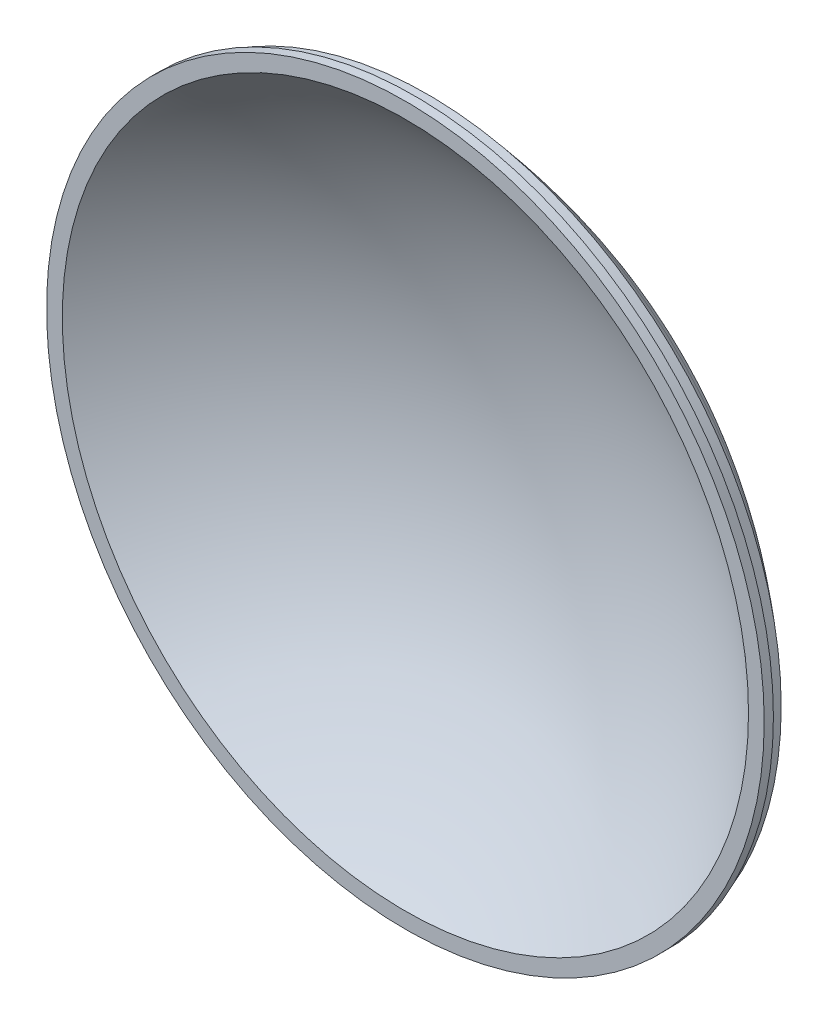
from build123d import *


with BuildPart() as part:
    # Sketch1 → Revolve2 (revolve)
    with BuildSketch(Plane(origin=(0, 0, 0), x_dir=(1, 0, 0), z_dir=(0, 1, 0))):
        with BuildLine():
            add(Edge.make_bspline(
                [(-0.008083422, 15.738478713), (0.28571155, 15.738629609), (0.840812888, 15.738004231), (1.868394508, 15.734546317), (2.901173429, 15.728381524), (4.227582271, 15.716441804), (5.821418054, 15.69484135), (8.416160181, 15.646050859), (11.658122448, 15.557987963), (16.84007731, 15.35978384), (23.313200419, 15.004179178), (33.65701245, 14.205024157), (46.550373188, 12.773741337), (77.317227425, 7.956225698), (122.56941407, -4.479354526), (169.462252379, -27.143119309), (204.131428921, -49.805714308), (220.433111859, -62.443094396), (228.3409107, -69.060966438)],
                knots=[0.059842647, 0.059842647, 0.059842647, 0.059842647, 0.061228771, 0.062614896, 0.064001021, 0.065387146, 0.068159395, 0.070931645, 0.076476144, 0.082020643, 0.093109642, 0.10419864, 0.126376637, 0.148554633, 0.23726662, 0.325978607, 0.3703346, 0.414690594, 0.414690594, 0.414690594, 0.414690594], degree=3))
            ThreePointArc((228.3409107, -69.060966438), (234.361374449, -74.128456773), (240.353010181, -79.23))
            Line((240.353010181, -79.23), (240.353010181, -87.93))
            Line((240.353010181, -87.93), (243.753010181, -87.93))
            Line((243.753010181, -87.93), (243.753010181, -94.18))
            Line((243.753010181, -94.18), (233.083010182, -94.18))
            add(Edge.make_bspline(
                [(0, 0), (0.266939648, 0.000137103), (0.667468659, -0.000237151), (1.309494404, -0.00184075), (2.313302637, -0.006545682), (3.297732932, -0.013581279), (4.686446483, -0.028531841), (6.547501661, -0.057747236), (8.74336209, -0.105365618), (11.232734976, -0.178382226), (13.731596233, -0.269986289), (16.224459485, -0.380192602), (18.719199955, -0.509003642), (21.211435822, -0.656427831), (23.703286723, -0.822469843), (26.193406356, -1.007135663), (28.682298722, -1.210429828), (31.169479544, -1.432356767), (33.654990027, -1.672919986), (36.138593881, -1.932122401), (41.72220182, -2.557270989), (50.387644384, -3.703719574), (62.093254849, -5.643373012), (76.752627936, -8.763191993), (90.04583252, -12.233605453), (101.990970719, -15.87716963), (112.617146492, -19.536466885), (121.959235079, -23.075184178), (131.189699299, -26.895595387), (140.300737443, -30.992641331), (151.531134831, -36.45248899), (164.740762146, -43.532969975), (179.736348642, -52.533097807), (196.267376585, -63.766850698), (211.734779433, -75.546517455), (222.779143, -84.85588764), (229.811527513, -91.162252337), (233.083010182, -94.18)],
                knots=[0.059842647, 0.059842647, 0.059842647, 0.059842647, 0.059842647, 0.061706068, 0.062637778, 0.063569489, 0.06543291, 0.067296331, 0.071023173, 0.074750016, 0.078476858, 0.0822037, 0.085930542, 0.089657384, 0.093384225, 0.097111065, 0.100837905, 0.104564746, 0.108291586, 0.112018426, 0.115745267, 0.119472107, 0.141833167, 0.16419423, 0.186555296, 0.208916361, 0.2238237, 0.23873104, 0.253638401, 0.268545762, 0.283453152, 0.298360542, 0.328175309, 0.35798999, 0.387804638, 0.417619438, 0.444190198, 0.444190198, 0.444190198, 0.444190198, 0.444190198], degree=4))
            Line((0, 0), (-0.008083422, 15.738478713))
        make_face()
    revolve(axis=Axis((0, 0, 0), (-0.0005136087626864871, 0, -0.9999998681030108)))


solid = part.part
